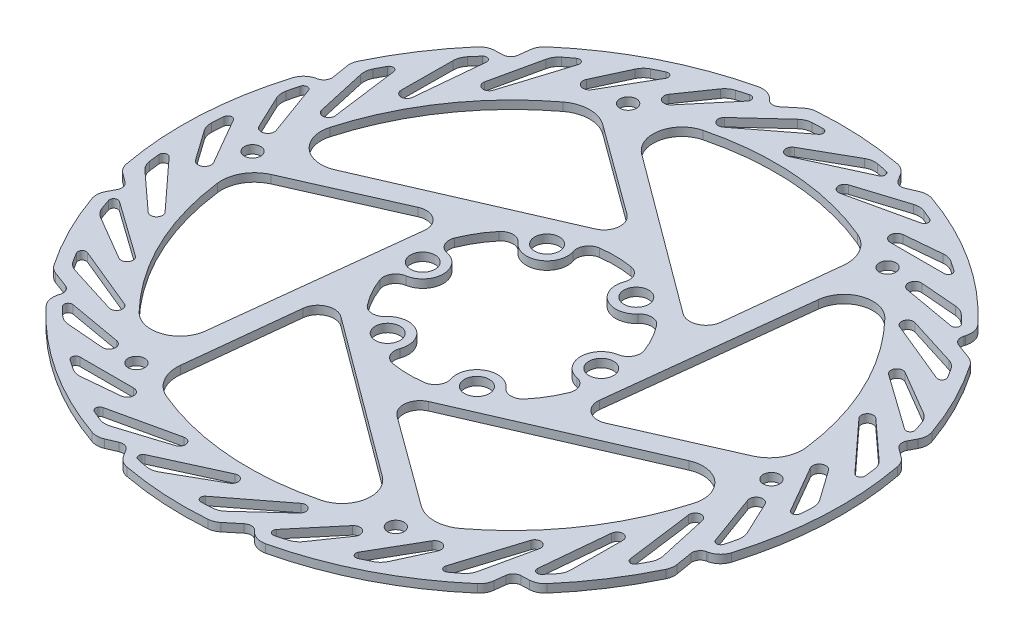
from build123d import *

# Parameters (mm, degrees)
SKETCH5_R           = 80
BOSS_EXTRUDE4_DEPTH = 2
SKETCH7_R           = 2
CUT_EXTRUDE7_DEPTH  = 114.154761279
SKETCH8_R           = 3
CUT_EXTRUDE11_DEPTH = 2
CUT_EXTRUDE12_DEPTH = 2
CUT_EXTRUDE13_DEPTH = 2
CUT_EXTRUDE14_DEPTH = 2
CUT_EXTRUDE15_DEPTH = 2


with BuildPart() as part:
    # Sketch5 → Boss-Extrude4 (new body)
    with BuildSketch(Plane(origin=(0, 0, 0), x_dir=(1, 0, 0), z_dir=(0, 1, 0))):
        with Locations(Location((0, 0, 0), (0, 0, 270))):
            Circle(SKETCH5_R)
    extrude(amount=BOSS_EXTRUDE4_DEPTH)

    # Sketch7 → Cut-Extrude7 (cut, through all)
    with BuildSketch(Plane(origin=(0, 0, 0), x_dir=(1, 0, 0), z_dir=(0, 1, 0))):
        with Locations(Location((-30.392913328, 58.585585424, 0), (0, 0, 270))):
            Circle(SKETCH7_R)
        with Locations(Location((35.540148608, 55.613827749, 0), (0, 0, 270))):
            Circle(SKETCH7_R)
        with Locations(Location((65.933061937, -2.971757675, 0), (0, 0, 270))):
            Circle(SKETCH7_R)
        with Locations(Location((30.392913328, -58.585585424, 0), (0, 0, 270))):
            Circle(SKETCH7_R)
        with Locations(Location((-35.540148608, -55.613827749, 0), (0, 0, 270))):
            Circle(SKETCH7_R)
        with Locations(Location((-65.933061937, 2.971757675, 0), (0, 0, 270))):
            Circle(SKETCH7_R)
    extrude(amount=CUT_EXTRUDE7_DEPTH, mode=Mode.SUBTRACT)

    # Sketch8 → Cut-Extrude11 (cut)
    with BuildSketch(Plane(origin=(0, 0, 0), x_dir=(1, 0, 0), z_dir=(0, 1, 0))):
        with Locations(Location((-10.707260616, 19.218599587, 0), (0, 0, 270))):
            Circle(SKETCH8_R)
        with Locations(Location((11.290165159, 18.882059492, 0), (0, 0, 270))):
            Circle(SKETCH8_R)
        with Locations(Location((21.997425776, -0.336540095, 0), (0, 0, 270))):
            Circle(SKETCH8_R)
        with Locations(Location((10.707260616, -19.218599587, 0), (0, 0, 270))):
            Circle(SKETCH8_R)
        with Locations(Location((-11.290165159, -18.882059492, 0), (0, 0, 270))):
            Circle(SKETCH8_R)
        with Locations(Location((-21.997425776, 0.336540095, 0), (0, 0, 270))):
            Circle(SKETCH8_R)
    extrude(amount=CUT_EXTRUDE11_DEPTH, mode=Mode.SUBTRACT)

    # Sketch9 → Cut-Extrude12 (cut)
    with BuildSketch(Plane(origin=(0, 0, 0), x_dir=(1, 0, 0), z_dir=(0, 1, 0))):
        with BuildLine():
            Line((-18.157811623, 49.627187948), (20.462317792, 21.063480965))
            ThreePointArc((20.462317792, 21.063480965), (24.447245904, 20.616180873), (26.817795882, 23.850407555))
            Line((26.817795882, 23.850407555), (29.718673824, 50.739314637))
            ThreePointArc((29.718673824, 50.739314637), (28.658868885, 55.656000155), (24.874088006, 58.968463995))
            ThreePointArc((24.874088006, 58.968463995), (4.830776111, 63.81742397), (-15.714067013, 62.040858295))
            ThreePointArc((-15.714067013, 62.040858295), (-20.863522769, 56.607203866), (-18.157811623, 49.627187948))
        make_face()
        with BuildLine():
            Line((33.89949967, 40.538720116), (28.472668504, -7.189146546))
            ThreePointArc((28.472668504, -7.189146546), (30.077759317, -10.863845569), (34.063956774, -11.299688729))
            Line((34.063956774, -11.299688729), (58.800872358, -0.36746918))
            ThreePointArc((58.800872358, -0.36746918), (62.52894445, 3.008691579), (63.505231844, 7.942639888))
            ThreePointArc((63.505231844, 7.942639888), (57.682898418, 27.725137153), (45.871925849, 44.629210377))
            ThreePointArc((45.871925849, 44.629210377), (38.591515201, 46.371942663), (33.89949967, 40.538720116))
        make_face()
        with BuildLine():
            Line((52.057311293, -9.088467831), (8.010350712, -28.252627511))
            ThreePointArc((8.010350712, -28.252627511), (5.630513413, -31.480026442), (7.246160893, -35.150096285))
            Line((7.246160893, -35.150096285), (29.082198534, -51.106783817))
            ThreePointArc((29.082198534, -51.106783817), (33.870075565, -52.647308576), (38.631143838, -51.025824106))
            ThreePointArc((38.631143838, -51.025824106), (52.852122307, -36.092286817), (61.585992862, -17.411647918))
            ThreePointArc((61.585992862, -17.411647918), (59.45503797, -10.235261203), (52.057311293, -9.088467831))
        make_face()
        with BuildLine():
            Line((18.157811623, -49.627187948), (-20.462317792, -21.063480965))
            ThreePointArc((-20.462317792, -21.063480965), (-24.447245904, -20.616180873), (-26.817795882, -23.850407555))
            Line((-26.817795882, -23.850407555), (-29.718673824, -50.739314637))
            ThreePointArc((-29.718673824, -50.739314637), (-28.658868885, -55.656000155), (-24.874088006, -58.968463995))
            ThreePointArc((-24.874088006, -58.968463995), (-4.830776111, -63.81742397), (15.714067013, -62.040858295))
            ThreePointArc((15.714067013, -62.040858295), (20.863522769, -56.607203866), (18.157811623, -49.627187948))
        make_face()
        with BuildLine():
            Line((-33.89949967, -40.538720116), (-28.472668504, 7.189146546))
            ThreePointArc((-28.472668504, 7.189146546), (-30.077759317, 10.863845569), (-34.063956774, 11.299688729))
            Line((-34.063956774, 11.299688729), (-58.800872358, 0.36746918))
            ThreePointArc((-58.800872358, 0.36746918), (-62.52894445, -3.008691579), (-63.505231844, -7.942639888))
            ThreePointArc((-63.505231844, -7.942639888), (-57.682898418, -27.725137153), (-45.871925849, -44.629210377))
            ThreePointArc((-45.871925849, -44.629210377), (-38.591515201, -46.371942663), (-33.89949967, -40.538720116))
        make_face()
        with BuildLine():
            Line((-52.057311293, 9.088467831), (-8.010350712, 28.252627511))
            ThreePointArc((-8.010350712, 28.252627511), (-5.630513413, 31.480026442), (-7.246160893, 35.150096285))
            Line((-7.246160893, 35.150096285), (-29.082198534, 51.106783817))
            ThreePointArc((-29.082198534, 51.106783817), (-33.870075565, 52.647308576), (-38.631143838, 51.025824106))
            ThreePointArc((-38.631143838, 51.025824106), (-52.852122307, 36.092286817), (-61.585992862, 17.411647918))
            ThreePointArc((-61.585992862, 17.411647918), (-59.45503797, 10.235261203), (-52.057311293, 9.088467831))
        make_face()
    extrude(amount=CUT_EXTRUDE12_DEPTH, mode=Mode.SUBTRACT)

    # Sketch10 → Cut-Extrude13 (cut)
    with BuildSketch(Plane(origin=(0, 0, 0), x_dir=(1, 0, 0), z_dir=(0, 1, 0))):
        with BuildLine():
            ThreePointArc((4.309033234, 24.62584481), (0.382431926, 24.997074745), (-3.553687966, 24.746137109))
            ThreePointArc((-3.553687966, 24.746137109), (-5.682699815, 23.348113553), (-5.969751112, 20.817350255))
            ThreePointArc((-5.969751112, 20.817350255), (-8.273792294, 14.850736045), (-14.559872549, 16.031534904))
            ThreePointArc((-14.559872549, 16.031534904), (-16.862906052, 17.119283956), (-19.172090578, 16.044654651))
            ThreePointArc((-19.172090578, 16.044654651), (-21.456885787, 12.829733136), (-23.207627365, 9.295484499))
            ThreePointArc((-23.207627365, 9.295484499), (-23.061409375, 6.752694375), (-21.013229717, 5.23871901))
            ThreePointArc((-21.013229717, 5.23871901), (-16.998010827, 0.26005371), (-21.163652762, -4.593452051))
            ThreePointArc((-21.163652762, -4.593452051), (-23.257187826, -6.044063044), (-23.481123812, -8.581190158))
            ThreePointArc((-23.481123812, -8.581190158), (-21.839317713, -12.16734161), (-19.653939399, -15.45065261))
            ThreePointArc((-19.653939399, -15.45065261), (-17.37870956, -16.595419178), (-15.043478605, -15.578631245))
            ThreePointArc((-15.043478605, -15.578631245), (-8.724218532, -14.590682335), (-6.603780214, -20.624986955))
            ThreePointArc((-6.603780214, -20.624986955), (-6.394281775, -23.163347), (-4.309033234, -24.62584481))
            ThreePointArc((-4.309033234, -24.62584481), (-0.382431926, -24.997074745), (3.553687966, -24.746137109))
            ThreePointArc((3.553687966, -24.746137109), (5.682699815, -23.348113553), (5.969751112, -20.817350255))
            ThreePointArc((5.969751112, -20.817350255), (8.273792294, -14.850736045), (14.559872549, -16.031534904))
            ThreePointArc((14.559872549, -16.031534904), (16.862906052, -17.119283956), (19.172090578, -16.044654651))
            ThreePointArc((19.172090578, -16.044654651), (21.456885787, -12.829733136), (23.207627365, -9.295484499))
            ThreePointArc((23.207627365, -9.295484499), (23.061409375, -6.752694375), (21.013229717, -5.23871901))
            ThreePointArc((21.013229717, -5.23871901), (16.998010827, -0.26005371), (21.163652762, 4.593452051))
            ThreePointArc((21.163652762, 4.593452051), (23.257187826, 6.044063044), (23.481123812, 8.581190158))
            ThreePointArc((23.481123812, 8.581190158), (21.839317713, 12.16734161), (19.653939399, 15.45065261))
            ThreePointArc((19.653939399, 15.45065261), (17.37870956, 16.595419178), (15.043478605, 15.578631245))
            ThreePointArc((15.043478605, 15.578631245), (8.724218532, 14.590682335), (6.603780214, 20.624986955))
            ThreePointArc((6.603780214, 20.624986955), (6.394281775, 23.163347), (4.309033234, 24.62584481))
        make_face()
    extrude(amount=CUT_EXTRUDE13_DEPTH, mode=Mode.SUBTRACT)

    # Sketch11 → Cut-Extrude14 (cut)
    with BuildSketch(Plane(origin=(0, 0, 0), x_dir=(1, 0, 0), z_dir=(0, 1, 0))):
        with BuildLine():
            Line((-43.668488492, -61.201793486), (-30.611785922, -61.201793486))
            ThreePointArc((-30.611785922, -61.201793486), (-29.01349056, -62.727956251), (-30.464268785, -64.394978564))
            Line((-30.464268785, -64.394978564), (-39.368949969, -65.219486081))
            ThreePointArc((-39.368949969, -65.219486081), (-40.694939297, -65.120306964), (-41.915153376, -64.591949324))
            ThreePointArc((-41.915153376, -64.591949324), (-43.086280873, -63.816709415), (-44.243073867, -63.020238137))
            ThreePointArc((-44.243073867, -63.020238137), (-44.622019994, -61.900500149), (-43.668488492, -61.201793486))
        make_face()
        with BuildLine():
            Line((-55.486113368, -51.037521076), (-42.627771448, -53.304793684))
            ThreePointArc((-42.627771448, -53.304793684), (-41.318773167, -55.085311684), (-43.036986198, -56.475083188))
            Line((-43.036986198, -56.475083188), (-51.949559494, -55.740782923))
            ThreePointArc((-51.949559494, -55.740782923), (-53.238181791, -55.412854929), (-54.348109735, -54.680636277))
            ThreePointArc((-54.348109735, -54.680636277), (-55.366826176, -53.713809849), (-56.3677391, -52.728563764))
            ThreePointArc((-56.3677391, -52.728563764), (-56.546487723, -51.560033808), (-55.486113368, -51.037521076))
        make_face()
        with BuildLine():
            Line((-64.6875682, -38.344214628), (-49.472481746, -44.622652965))
            ThreePointArc((-49.472481746, -44.622652965), (-48.662370491, -46.457150014), (-50.459801715, -47.346475976))
            Line((-50.459801715, -47.346475976), (-62.406763228, -43.596699735))
            ThreePointArc((-62.406763228, -43.596699735), (-63.627446711, -42.966279744), (-64.562818304, -41.960010637))
            ThreePointArc((-64.562818304, -41.960010637), (-65.253062147, -40.878330206), (-65.925185371, -39.78529796))
            ThreePointArc((-65.925185371, -39.78529796), (-65.827645349, -38.617085497), (-64.6875682, -38.344214628))
        make_face()
        with BuildLine():
            Line((-71.553133846, -23.716518134), (-58.140350396, -33.256690243))
            ThreePointArc((-58.140350396, -33.256690243), (-57.763674285, -35.226404633), (-59.715092276, -35.68860318))
            Line((-59.715092276, -35.68860318), (-70.51233782, -29.347451872))
            ThreePointArc((-70.51233782, -29.347451872), (-71.559921623, -28.458595468), (-72.244958406, -27.267704147))
            ThreePointArc((-72.244958406, -27.267704147), (-72.674186191, -26.058476035), (-73.083204184, -24.842263307))
            ThreePointArc((-73.083204184, -24.842263307), (-72.725373481, -23.725933784), (-71.553133846, -23.716518134))
        make_face()
        with BuildLine():
            Line((-74.902865693, -8.31202226), (-63.766697056, -20.432393204))
            ThreePointArc((-63.766697056, -20.432393204), (-63.807778872, -22.437379976), (-65.812650179, -22.483755761))
            Line((-65.812650179, -22.483755761), (-75.055550512, -14.036300247))
            ThreePointArc((-75.055550512, -14.036300247), (-75.895438458, -12.949062568), (-76.317905315, -11.641767924))
            ThreePointArc((-76.317905315, -11.641767924), (-76.486340782, -10.369722873), (-76.633555906, -9.095047688))
            ThreePointArc((-76.633555906, -9.095047688), (-76.051446703, -8.07750983), (-74.902865693, -8.31202226))
        make_face()
        with BuildLine():
            Line((-49.683567845, 57.981863315), (-52.377828751, 45.753549064))
            ThreePointArc((-52.377828751, 45.753549064), (-51.335230489, 44.040467474), (-49.578320103, 45.007382964))
            Line((-49.578320103, 45.007382964), (-44.64985528, 60.711773377))
            ThreePointArc((-44.64985528, 60.711773377), (-45.021052064, 61.823729924), (-46.193320299, 61.819082353))
            ThreePointArc((-46.193320299, 61.819082353), (-47.223613829, 61.054252723), (-48.241019425, 60.272360805))
            ThreePointArc((-48.241019425, 60.272360805), (-49.161936368, 59.252846452), (-49.683567845, 57.981863315))
        make_face()
        with BuildLine():
            Line((-56.315674117, 50.108572564), (-57.871313794, 33.722675306))
            ThreePointArc((-57.871313794, 33.722675306), (-59.388798439, 32.41160703), (-60.764783117, 33.870485311))
            Line((-60.764783117, 33.870485311), (-60.671807768, 46.391749896))
            ThreePointArc((-60.671807768, 46.391749896), (-60.425827443, 47.743412285), (-59.737003698, 48.932117201))
            ThreePointArc((-59.737003698, 48.932117201), (-58.904395326, 49.908453423), (-58.055633203, 50.87077976))
            ThreePointArc((-58.055633203, 50.87077976), (-56.909948126, 51.119054042), (-56.315674117, 50.108572564))
        make_face()
        with BuildLine():
            Line((-68.959231106, 32.247492455), (-66.233151833, 20.026232167))
            ThreePointArc((-66.233151833, 20.026232167), (-64.564257345, 18.914274047), (-63.380591925, 20.533099498))
            Line((-63.380591925, 20.533099498), (-65.550848056, 36.848970056))
            ThreePointArc((-65.550848056, 36.848970056), (-66.357199734, 37.699870395), (-67.417671416, 37.200236301))
            ThreePointArc((-67.417671416, 37.200236301), (-68.028203496, 36.071644391), (-68.619844307, 34.933035472))
            ThreePointArc((-68.619844307, 34.933035472), (-69.02361312, 33.619845358), (-68.959231106, 32.247492455))
        make_face()
        with BuildLine():
            Line((-71.942846482, 22.533623196), (-67.477191197, 10.264336139))
            ThreePointArc((-67.477191197, 10.264336139), (-68.364665878, 8.240451374), (-70.42734982, 9.033581756))
            Line((-70.42734982, 9.033581756), (-74.247713785, 17.119246776))
            ThreePointArc((-74.247713785, 17.119246776), (-74.60803096, 18.399190418), (-74.528874979, 19.72652554))
            ThreePointArc((-74.528874979, 19.72652554), (-74.200936951, 21.092173071), (-73.848145274, 22.451612132))
            ThreePointArc((-73.848145274, 22.451612132), (-72.925542959, 23.190677959), (-71.942846482, 22.533623196))
        make_face()
        with BuildLine():
            Line((-74.836552162, 7.217123636), (-68.308200877, -4.090312479))
            ThreePointArc((-68.308200877, -4.090312479), (-68.830748921, -6.237558248), (-70.999821705, -5.814658607))
            Line((-70.999821705, -5.814658607), (-76.166206753, 1.484767753))
            ThreePointArc((-76.166206753, 1.484767753), (-76.743309781, 2.682697755), (-76.895845682, 4.003612965))
            ThreePointArc((-76.895845682, 4.003612965), (-76.810031976, 5.405459083), (-76.698664112, 6.805506842))
            ThreePointArc((-76.698664112, 6.805506842), (-75.918415633, 7.693552808), (-74.836552162, 7.217123636))
        make_face()
        with BuildLine():
            Line((25.371982667, 72.018163562), (13.434821428, 68.237304826))
            ThreePointArc((13.434821428, 68.237304826), (12.472548382, 66.47784745), (14.188376953, 65.439776168))
            Line((14.188376953, 65.439776168), (30.253010413, 69.023795636))
            ThreePointArc((30.253010413, 69.023795636), (31.030394639, 69.901239755), (30.440235606, 70.914130041))
            ThreePointArc((30.440235606, 70.914130041), (29.262726953, 71.423975596), (28.07688589, 71.914128729))
            ThreePointArc((28.07688589, 71.914128729), (26.73350209, 72.20190902), (25.371982667, 72.018163562))
        make_face()
        with BuildLine():
            Line((15.237459729, 73.825090698), (0.269036601, 66.979365549))
            ThreePointArc((0.269036601, 66.979365549), (-1.625124154, 67.638011664), (-1.049690841, 69.55908849))
            Line((-1.049690841, 69.55908849), (9.840530052, 75.739201769))
            ThreePointArc((9.840530052, 75.739201769), (11.13409418, 76.202007753), (12.507954709, 76.199821349))
            ThreePointArc((12.507954709, 76.199821349), (13.769790865, 75.966929458), (15.027570981, 75.713043067))
            ThreePointArc((15.027570981, 75.713043067), (15.815425355, 74.844987826), (15.237459729, 73.825090698))
        make_face()
        with BuildLine():
            Line((-6.552467878, 75.844192191), (-15.773350118, 67.372708143))
            ThreePointArc((-15.773350118, 67.372708143), (-15.901886854, 65.371424061), (-13.908110179, 65.155752463))
            Line((-13.908110179, 65.155752463), (-0.863279856, 75.193184684))
            ThreePointArc((-0.863279856, 75.193184684), (-0.529554386, 76.316955891), (-1.492486045, 76.985534261))
            ThreePointArc((-1.492486045, 76.985534261), (-2.775141349, 76.949974597), (-4.057026003, 76.89304611))
            ThreePointArc((-4.057026003, 76.89304611), (-5.396166409, 76.586125102), (-6.552467878, 75.844192191))
        make_face()
        with BuildLine():
            Line((-16.456733114, 73.571144272), (-24.84941975, 63.569129822))
            ThreePointArc((-24.84941975, 63.569129822), (-27.04589271, 63.325763058), (-27.390363623, 65.508664943))
            Line((-27.390363623, 65.508664943), (-22.298154291, 72.860029698))
            ThreePointArc((-22.298154291, 72.860029698), (-21.369849169, 73.812045347), (-20.180765243, 74.407161817))
            ThreePointArc((-20.180765243, 74.407161817), (-18.834110775, 74.80598292), (-17.480406175, 75.180175896))
            ThreePointArc((-17.480406175, 75.180175896), (-16.379055236, 74.750711767), (-16.456733114, 73.571144272))
        make_face()
        with BuildLine():
            Line((-31.16806367, 68.418917122), (-37.696414955, 57.111481006))
            ThreePointArc((-37.696414955, 57.111481006), (-39.817258361, 56.490398003), (-40.53555292, 58.580319957))
            Line((-40.53555292, 58.580319957), (-36.797256784, 66.704253834))
            ThreePointArc((-36.797256784, 66.704253834), (-36.048370485, 67.803004718), (-34.980692306, 68.595562289))
            ThreePointArc((-34.980692306, 68.595562289), (-33.723751103, 69.222168498), (-32.455590246, 69.825744979))
            ThreePointArc((-32.455590246, 69.825744979), (-31.296395639, 69.594052958), (-31.16806367, 68.418917122))
        make_face()
        with BuildLine():
            Line((75.055550512, 14.036300247), (65.812650179, 22.483755761))
            ThreePointArc((65.812650179, 22.483755761), (63.807778872, 22.437379976), (63.766697056, 20.432393204))
            Line((63.766697056, 20.432393204), (74.902865693, 8.31202226))
            ThreePointArc((74.902865693, 8.31202226), (76.051446703, 8.07750983), (76.633555906, 9.095047688))
            ThreePointArc((76.633555906, 9.095047688), (76.486340782, 10.369722873), (76.317905315, 11.641767924))
            ThreePointArc((76.317905315, 11.641767924), (75.895438458, 12.949062568), (75.055550512, 14.036300247))
        make_face()
        with BuildLine():
            Line((71.553133846, 23.716518134), (58.140350396, 33.256690243))
            ThreePointArc((58.140350396, 33.256690243), (57.763674285, 35.226404633), (59.715092276, 35.68860318))
            Line((59.715092276, 35.68860318), (70.51233782, 29.347451872))
            ThreePointArc((70.51233782, 29.347451872), (71.559921623, 28.458595468), (72.244958406, 27.267704147))
            ThreePointArc((72.244958406, 27.267704147), (72.674186191, 26.058476035), (73.083204184, 24.842263307))
            ThreePointArc((73.083204184, 24.842263307), (72.725373481, 23.725933784), (71.553133846, 23.716518134))
        make_face()
        with BuildLine():
            Line((62.406763228, 43.596699735), (50.459801715, 47.346475976))
            ThreePointArc((50.459801715, 47.346475976), (48.662370491, 46.457150014), (49.472481746, 44.622652965))
            Line((49.472481746, 44.622652965), (64.6875682, 38.344214628))
            ThreePointArc((64.6875682, 38.344214628), (65.827645349, 38.617085497), (65.925185371, 39.78529796))
            ThreePointArc((65.925185371, 39.78529796), (65.253062147, 40.878330206), (64.562818304, 41.960010637))
            ThreePointArc((64.562818304, 41.960010637), (63.627446711, 42.966279744), (62.406763228, 43.596699735))
        make_face()
        with BuildLine():
            Line((55.486113368, 51.037521076), (42.627771448, 53.304793684))
            ThreePointArc((42.627771448, 53.304793684), (41.318773167, 55.085311684), (43.036986198, 56.475083188))
            Line((43.036986198, 56.475083188), (51.949559494, 55.740782923))
            ThreePointArc((51.949559494, 55.740782923), (53.238181791, 55.412854929), (54.348109735, 54.680636277))
            ThreePointArc((54.348109735, 54.680636277), (55.366826176, 53.713809849), (56.3677391, 52.728563764))
            ThreePointArc((56.3677391, 52.728563764), (56.546487723, 51.560033808), (55.486113368, 51.037521076))
        make_face()
        with BuildLine():
            Line((43.668488492, 61.201793486), (30.611785922, 61.201793486))
            ThreePointArc((30.611785922, 61.201793486), (29.01349056, 62.727956251), (30.464268785, 64.394978564))
            Line((30.464268785, 64.394978564), (39.368949969, 65.219486081))
            ThreePointArc((39.368949969, 65.219486081), (40.694939297, 65.120306964), (41.915153376, 64.591949324))
            ThreePointArc((41.915153376, 64.591949324), (43.086280873, 63.816709415), (44.243073867, 63.020238137))
            ThreePointArc((44.243073867, 63.020238137), (44.622019994, 61.900500149), (43.668488492, 61.201793486))
        make_face()
        with BuildLine():
            Line((49.683567845, -57.981863315), (52.377828751, -45.753549064))
            ThreePointArc((52.377828751, -45.753549064), (51.335230489, -44.040467474), (49.578320103, -45.007382964))
            Line((49.578320103, -45.007382964), (44.64985528, -60.711773377))
            ThreePointArc((44.64985528, -60.711773377), (45.021052064, -61.823729924), (46.193320299, -61.819082353))
            ThreePointArc((46.193320299, -61.819082353), (47.223613829, -61.054252723), (48.241019425, -60.272360805))
            ThreePointArc((48.241019425, -60.272360805), (49.161936368, -59.252846452), (49.683567845, -57.981863315))
        make_face()
        with BuildLine():
            Line((56.315674117, -50.108572564), (57.871313794, -33.722675306))
            ThreePointArc((57.871313794, -33.722675306), (59.388798439, -32.41160703), (60.764783117, -33.870485311))
            Line((60.764783117, -33.870485311), (60.671807768, -46.391749896))
            ThreePointArc((60.671807768, -46.391749896), (60.425827443, -47.743412285), (59.737003698, -48.932117201))
            ThreePointArc((59.737003698, -48.932117201), (58.904395326, -49.908453423), (58.055633203, -50.87077976))
            ThreePointArc((58.055633203, -50.87077976), (56.909948126, -51.119054042), (56.315674117, -50.108572564))
        make_face()
        with BuildLine():
            Line((68.959231106, -32.247492455), (66.233151833, -20.026232167))
            ThreePointArc((66.233151833, -20.026232167), (64.564257345, -18.914274047), (63.380591925, -20.533099498))
            Line((63.380591925, -20.533099498), (65.550848056, -36.848970056))
            ThreePointArc((65.550848056, -36.848970056), (66.357199734, -37.699870395), (67.417671416, -37.200236301))
            ThreePointArc((67.417671416, -37.200236301), (68.028203496, -36.071644391), (68.619844307, -34.933035472))
            ThreePointArc((68.619844307, -34.933035472), (69.02361312, -33.619845358), (68.959231106, -32.247492455))
        make_face()
        with BuildLine():
            Line((71.942846482, -22.533623196), (67.477191197, -10.264336139))
            ThreePointArc((67.477191197, -10.264336139), (68.364665878, -8.240451374), (70.42734982, -9.033581756))
            Line((70.42734982, -9.033581756), (74.247713785, -17.119246776))
            ThreePointArc((74.247713785, -17.119246776), (74.60803096, -18.399190418), (74.528874979, -19.72652554))
            ThreePointArc((74.528874979, -19.72652554), (74.200936951, -21.092173071), (73.848145274, -22.451612132))
            ThreePointArc((73.848145274, -22.451612132), (72.925542959, -23.190677959), (71.942846482, -22.533623196))
        make_face()
        with BuildLine():
            Line((74.836552162, -7.217123636), (68.308200877, 4.090312479))
            ThreePointArc((68.308200877, 4.090312479), (68.830748921, 6.237558248), (70.999821705, 5.814658607))
            Line((70.999821705, 5.814658607), (76.166206753, -1.484767753))
            ThreePointArc((76.166206753, -1.484767753), (76.743309781, -2.682697755), (76.895845682, -4.003612965))
            ThreePointArc((76.895845682, -4.003612965), (76.810031976, -5.405459083), (76.698664112, -6.805506842))
            ThreePointArc((76.698664112, -6.805506842), (75.918415633, -7.693552808), (74.836552162, -7.217123636))
        make_face()
        with BuildLine():
            Line((-25.371982667, -72.018163562), (-13.434821428, -68.237304826))
            ThreePointArc((-13.434821428, -68.237304826), (-12.472548382, -66.47784745), (-14.188376953, -65.439776168))
            Line((-14.188376953, -65.439776168), (-30.253010413, -69.023795636))
            ThreePointArc((-30.253010413, -69.023795636), (-31.030394639, -69.901239755), (-30.440235606, -70.914130041))
            ThreePointArc((-30.440235606, -70.914130041), (-29.262726953, -71.423975596), (-28.07688589, -71.914128729))
            ThreePointArc((-28.07688589, -71.914128729), (-26.73350209, -72.20190902), (-25.371982667, -72.018163562))
        make_face()
        with BuildLine():
            Line((-15.237459729, -73.825090698), (-0.269036601, -66.979365549))
            ThreePointArc((-0.269036601, -66.979365549), (1.625124154, -67.638011664), (1.049690841, -69.55908849))
            Line((1.049690841, -69.55908849), (-9.840530052, -75.739201769))
            ThreePointArc((-9.840530052, -75.739201769), (-11.13409418, -76.202007753), (-12.507954709, -76.199821349))
            ThreePointArc((-12.507954709, -76.199821349), (-13.769790865, -75.966929458), (-15.027570981, -75.713043067))
            ThreePointArc((-15.027570981, -75.713043067), (-15.815425355, -74.844987826), (-15.237459729, -73.825090698))
        make_face()
        with BuildLine():
            Line((6.552467878, -75.844192191), (15.773350118, -67.372708143))
            ThreePointArc((15.773350118, -67.372708143), (15.901886854, -65.371424061), (13.908110179, -65.155752463))
            Line((13.908110179, -65.155752463), (0.863279856, -75.193184684))
            ThreePointArc((0.863279856, -75.193184684), (0.529554386, -76.316955891), (1.492486045, -76.985534261))
            ThreePointArc((1.492486045, -76.985534261), (2.775141349, -76.949974597), (4.057026003, -76.89304611))
            ThreePointArc((4.057026003, -76.89304611), (5.396166409, -76.586125102), (6.552467878, -75.844192191))
        make_face()
        with BuildLine():
            Line((16.456733114, -73.571144272), (24.84941975, -63.569129822))
            ThreePointArc((24.84941975, -63.569129822), (27.04589271, -63.325763058), (27.390363623, -65.508664943))
            Line((27.390363623, -65.508664943), (22.298154291, -72.860029698))
            ThreePointArc((22.298154291, -72.860029698), (21.369849169, -73.812045347), (20.180765243, -74.407161817))
            ThreePointArc((20.180765243, -74.407161817), (18.834110775, -74.80598292), (17.480406175, -75.180175896))
            ThreePointArc((17.480406175, -75.180175896), (16.379055236, -74.750711767), (16.456733114, -73.571144272))
        make_face()
        with BuildLine():
            Line((31.16806367, -68.418917122), (37.696414955, -57.111481006))
            ThreePointArc((37.696414955, -57.111481006), (39.817258361, -56.490398003), (40.53555292, -58.580319957))
            Line((40.53555292, -58.580319957), (36.797256784, -66.704253834))
            ThreePointArc((36.797256784, -66.704253834), (36.048370485, -67.803004718), (34.980692306, -68.595562289))
            ThreePointArc((34.980692306, -68.595562289), (33.723751103, -69.222168498), (32.455590246, -69.825744979))
            ThreePointArc((32.455590246, -69.825744979), (31.296395639, -69.594052958), (31.16806367, -68.418917122))
        make_face()
    extrude(amount=CUT_EXTRUDE14_DEPTH, mode=Mode.SUBTRACT)

    # Sketch12 → Cut-Extrude15 (cut)
    with BuildSketch(Plane(origin=(0, 0, 0), x_dir=(1, 0, 0), z_dir=(0, 1, 0))):
        with BuildLine():
            Line((-57.76349749, 53.557915462), (-55.827319761, 53.628751232))
            ThreePointArc((-55.827319761, 53.628751232), (-54.545007056, 54.156768896), (-53.914363048, 55.391846489))
            Line((-53.914363048, 55.391846489), (-53.601556469, 58.02912954))
            ThreePointArc((-53.601556469, 58.02912954), (-53.16127745, 59.435715727), (-52.241473073, 60.587362471))
            ThreePointArc((-52.241473073, 60.587362471), (-56.602328391, 56.534736408), (-60.649740912, 52.169041848))
            ThreePointArc((-60.649740912, 52.169041848), (-59.351706127, 53.164986425), (-57.76349749, 53.557915462))
        make_face()
        with BuildLine():
            Line((-72.411820171, 32.337111483), (-71.752532396, 28.361973491))
            ThreePointArc((-71.752532396, 28.361973491), (-72.063153976, 26.922829909), (-73.27465255, 26.086234892))
            Line((-73.27465255, 26.086234892), (-73.614451833, 26.007597691))
            ThreePointArc((-73.614451833, 26.007597691), (-75.443565011, 25.033229486), (-76.539575669, 23.274306788))
            ThreePointArc((-76.539575669, 23.274306788), (-74.524744466, 29.087152872), (-72.069184122, 34.727981514))
            ThreePointArc((-72.069184122, 34.727981514), (-72.425271357, 33.55902581), (-72.411820171, 32.337111483))
        make_face()
        with BuildLine():
            Line((23.453922106, 75.434874354), (21.013564698, 74.387131273))
            ThreePointArc((21.013564698, 74.387131273), (19.628634123, 74.315746209), (18.53020106, 75.162252754))
            Line((18.53020106, 75.162252754), (17.500766618, 76.803613968))
            ThreePointArc((17.500766618, 76.803613968), (16.366375772, 77.982578477), (14.854845075, 78.608737287))
            ThreePointArc((14.854845075, 78.608737287), (20.65935373, 77.286422504), (26.349458512, 75.536124048))
            ThreePointArc((26.349458512, 75.536124048), (24.892200986, 75.756874632), (23.453922106, 75.434874354))
        make_face()
        with BuildLine():
            Line((-14.283985625, 76.755784219), (-14.045984169, 76.500828008))
            ThreePointArc((-14.045984169, 76.500828008), (-12.715722345, 75.869936974), (-11.314076653, 76.320502587))
            Line((-11.314076653, 76.320502587), (-8.201150057, 78.879031544))
            ThreePointArc((-8.201150057, 78.879031544), (-7.149666801, 79.501637776), (-5.959277847, 79.777735036))
            ThreePointArc((-5.959277847, 79.777735036), (-12.072158922, 79.083898355), (-18.113646901, 77.922370318))
            ThreePointArc((-18.113646901, 77.922370318), (-16.042369832, 77.852658594), (-14.283985625, 76.755784219))
        make_face()
        with BuildLine():
            Line((77.055478575, 17.405744815), (74.927927746, 18.995284784))
            ThreePointArc((74.927927746, 18.995284784), (74.173641179, 20.158977312), (74.357520821, 21.533501522))
            Line((74.357520821, 21.533501522), (75.264264108, 23.245698507))
            ThreePointArc((75.264264108, 23.245698507), (75.7180819, 24.817592052), (75.504585987, 26.439695439))
            ThreePointArc((75.504585987, 26.439695439), (77.261682121, 20.751686096), (78.590931585, 14.948761576))
            ThreePointArc((78.590931585, 14.948761576), (78.053478436, 16.321158906), (77.055478575, 17.405744815))
        make_face()
        with BuildLine():
            Line((59.330466208, 50.748186528), (59.228668381, 50.414593116))
            ThreePointArc((59.228668381, 50.414593116), (59.34743163, 48.947107065), (60.438455743, 47.958529095))
            Line((60.438455743, 47.958529095), (64.210670115, 46.541920061))
            ThreePointArc((64.210670115, 46.541920061), (65.275604556, 45.942611966), (66.109906274, 45.049753522))
            ThreePointArc((66.109906274, 45.049753522), (62.452585544, 49.996745482), (58.425928768, 54.64806353))
            ThreePointArc((58.425928768, 54.64806353), (59.401195179, 52.819429109), (59.330466208, 50.748186528))
        make_face()
        with BuildLine():
            Line((53.601556469, -58.02912954), (53.914363048, -55.391846489))
            ThreePointArc((53.914363048, -55.391846489), (54.545007056, -54.156768896), (55.827319761, -53.628751232))
            Line((55.827319761, -53.628751232), (57.76349749, -53.557915462))
            ThreePointArc((57.76349749, -53.557915462), (59.351706127, -53.164986425), (60.649740912, -52.169041848))
            ThreePointArc((60.649740912, -52.169041848), (56.602328391, -56.534736408), (52.241473073, -60.587362471))
            ThreePointArc((52.241473073, -60.587362471), (53.16127745, -59.435715726), (53.601556469, -58.02912954))
        make_face()
        with BuildLine():
            Line((73.614451833, -26.007597691), (73.27465255, -26.086234892))
            ThreePointArc((73.27465255, -26.086234892), (72.063153976, -26.922829909), (71.752532396, -28.361973491))
            Line((71.752532396, -28.361973491), (72.411820171, -32.337111483))
            ThreePointArc((72.411820171, -32.337111483), (72.425271357, -33.55902581), (72.069184122, -34.727981514))
            ThreePointArc((72.069184122, -34.727981514), (74.524744466, -29.087152872), (76.539575669, -23.274306788))
            ThreePointArc((76.539575669, -23.274306788), (75.443565011, -25.033229485), (73.614451833, -26.007597691))
        make_face()
        with BuildLine():
            Line((-23.453922106, -75.434874354), (-21.013564698, -74.387131273))
            ThreePointArc((-21.013564698, -74.387131273), (-19.628634123, -74.315746209), (-18.53020106, -75.162252754))
            Line((-18.53020106, -75.162252754), (-17.500766618, -76.803613968))
            ThreePointArc((-17.500766618, -76.803613968), (-16.366375772, -77.982578477), (-14.854845075, -78.608737287))
            ThreePointArc((-14.854845075, -78.608737287), (-20.65935373, -77.286422504), (-26.349458512, -75.536124048))
            ThreePointArc((-26.349458512, -75.536124048), (-24.892200986, -75.756874632), (-23.453922106, -75.434874354))
        make_face()
        with BuildLine():
            Line((14.283985625, -76.755784219), (14.045984169, -76.500828008))
            ThreePointArc((14.045984169, -76.500828008), (12.715722345, -75.869936974), (11.314076653, -76.320502587))
            Line((11.314076653, -76.320502587), (8.201150057, -78.879031544))
            ThreePointArc((8.201150057, -78.879031544), (7.149666801, -79.501637776), (5.959277847, -79.777735036))
            ThreePointArc((5.959277847, -79.777735036), (12.072158922, -79.083898355), (18.113646901, -77.922370318))
            ThreePointArc((18.113646901, -77.922370318), (16.042369832, -77.852658594), (14.283985625, -76.755784219))
        make_face()
        with BuildLine():
            Line((-77.055478575, -17.405744815), (-74.927927746, -18.995284784))
            ThreePointArc((-74.927927746, -18.995284784), (-74.173641179, -20.158977312), (-74.357520821, -21.533501522))
            Line((-74.357520821, -21.533501522), (-75.264264108, -23.245698507))
            ThreePointArc((-75.264264108, -23.245698507), (-75.7180819, -24.817592052), (-75.504585987, -26.439695439))
            ThreePointArc((-75.504585987, -26.439695439), (-77.261682121, -20.751686096), (-78.590931585, -14.948761576))
            ThreePointArc((-78.590931585, -14.948761576), (-78.053478436, -16.321158906), (-77.055478575, -17.405744815))
        make_face()
        with BuildLine():
            Line((-59.330466208, -50.748186528), (-59.228668381, -50.414593116))
            ThreePointArc((-59.228668381, -50.414593116), (-59.34743163, -48.947107065), (-60.438455743, -47.958529095))
            Line((-60.438455743, -47.958529095), (-64.210670115, -46.541920061))
            ThreePointArc((-64.210670115, -46.541920061), (-65.275604556, -45.942611966), (-66.109906274, -45.049753522))
            ThreePointArc((-66.109906274, -45.049753522), (-62.452585544, -49.996745482), (-58.425928768, -54.64806353))
            ThreePointArc((-58.425928768, -54.64806353), (-59.401195179, -52.819429109), (-59.330466208, -50.748186528))
        make_face()
    extrude(amount=CUT_EXTRUDE15_DEPTH, mode=Mode.SUBTRACT)


solid = part.part
